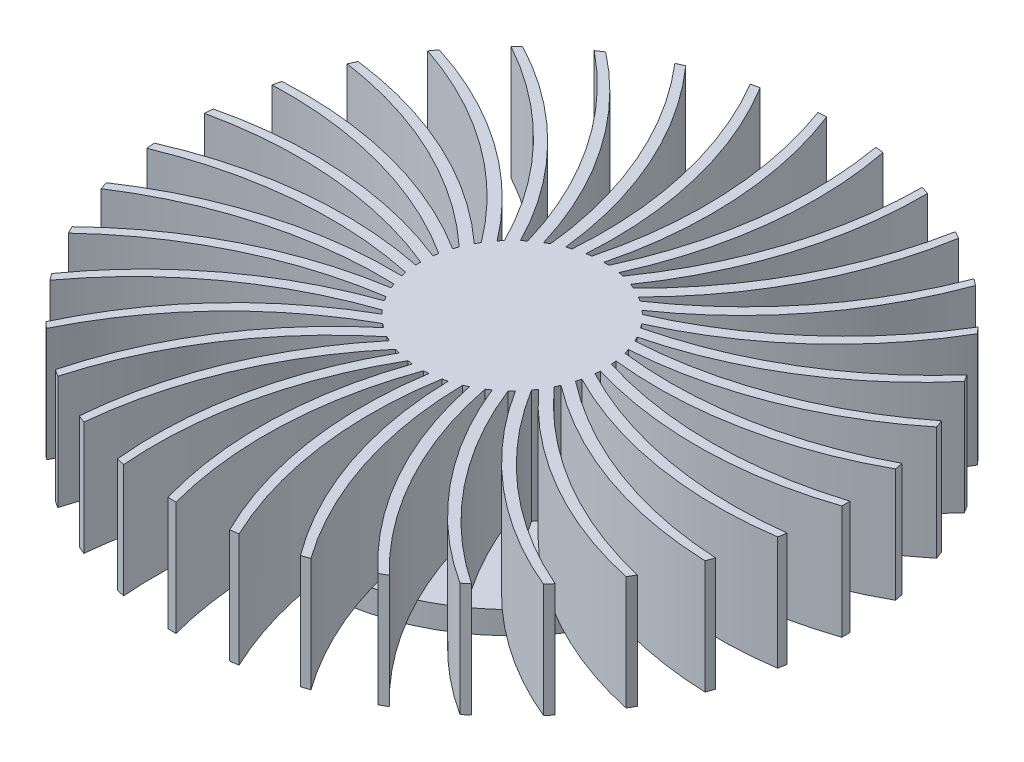
from build123d import *

# Parameters (mm, degrees)
SKETCH2_R          = 17.5
EXTRUDE1_DEPTH     = 2
SKETCH3_R          = 28.980111549
EXTRUDE2_DEPTH     = 10
CUT_EXTRUDE1_START = -10
CUT_EXTRUDE1_DEPTH = 10
CIRPATTERN2_COUNT  = 35


with BuildPart() as part:
    # Sketch2 → Extrude1 (new body)
    with BuildSketch(Plane(origin=(0, 1.905, 0), x_dir=(1, 0, 0), z_dir=(0, 1, 0))):
        with Locations(Location((0, 0, 0), (0, 0, 270))):
            Circle(SKETCH2_R)
    extrude(amount=EXTRUDE1_DEPTH)

    # Sketch3 → Extrude2 (add)
    with BuildSketch(Plane(origin=(0, 3.905, 0), x_dir=(1, 0, 0), z_dir=(0, 1, 0))):
        with Locations(Location((0, 0, 0), (0, 0, 270))):
            Circle(SKETCH3_R)
    extrude(amount=EXTRUDE2_DEPTH)

    # Sketch4 → Cut-Extrude1 (cut)
    with BuildSketch(Plane(origin=(0, 13.905, 0), x_dir=(1, 0, 0), z_dir=(0, 1, 0)).offset(CUT_EXTRUDE1_START)):
        with BuildLine():
            ThreePointArc((28.980111549, 0), (18.560005962, -1.793538321), (8.087422141, -0.337389892))
            ThreePointArc((8.087422141, -0.337389892), (8.074897142, -0.562374406), (8.056114501, -0.786923108))
            ThreePointArc((8.056114501, -0.786923108), (18.064408878, -4.198483759), (28.634965209, -4.459330985))
            ThreePointArc((28.634965209, -4.459330985), (28.893696123, -2.236333988), (28.980111549, 0))
        make_face()
    cut_extrude1 = extrude(amount=CUT_EXTRUDE1_DEPTH, mode=Mode.SUBTRACT)

    # CirPattern2: Cut-Extrude1 ×35 about axis
    cirpattern2_axis = Axis((0, 0, 0), (0, 1, 0))
    for i in range(1, CIRPATTERN2_COUNT):
        add(cut_extrude1.rotate(cirpattern2_axis, i * 360 / CIRPATTERN2_COUNT), mode=Mode.SUBTRACT)


solid = part.part
